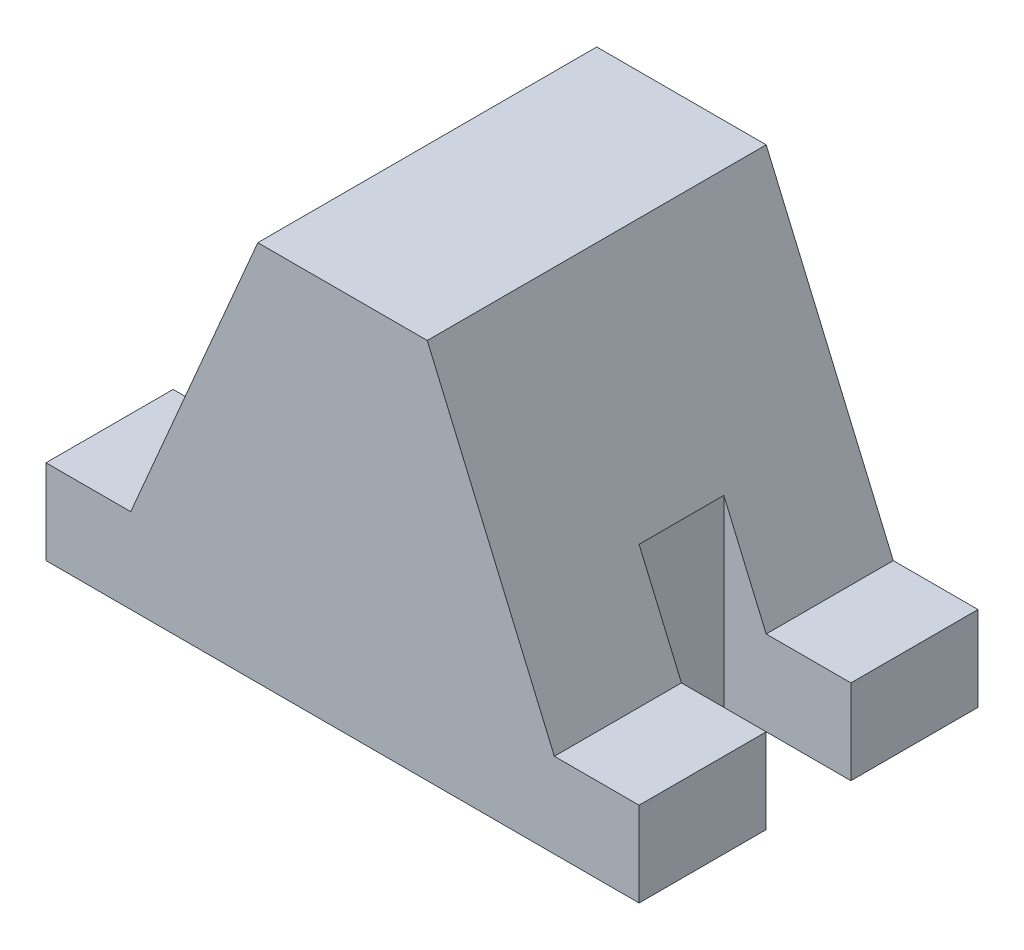
from build123d import *

# Parameters (mm, degrees)
SALIENTE_EXTRUIR1_DEPTH = 20
CORTAR_EXTRUIR2_REACH   = 62.415
CROQUIS2_W              = 15
CROQUIS2_H              = 10


with BuildPart() as part:
    # Croquis1 → Saliente-Extruir1 (new, symmetric)
    with BuildSketch(Plane.XY):
        Polygon((-35, 0), (35, 0), (35, 10), (25, 10), (10, 45), (-10, 45), (-25, 10), (-35, 10), align=None)
    extrude(amount=SALIENTE_EXTRUIR1_DEPTH, both=True)

    # Croquis2 → Cortar-Extruir2 (cut, up to next)
    with BuildSketch(Plane.XZ, mode=Mode.PRIVATE) as cortar_extruir2_sk1:
        with Locations((27.5, 0)):
            Rectangle(CROQUIS2_W, CROQUIS2_H)
    cortar_extruir2_tool1 = extrude(cortar_extruir2_sk1.sketch, amount=-CORTAR_EXTRUIR2_REACH, mode=Mode.PRIVATE) & part.part
    # Croquis2 → Cortar-Extruir2 (cut, up to next)
    with BuildSketch(Plane.XZ, mode=Mode.PRIVATE) as cortar_extruir2_sk2:
        with Locations((-27.5, 0)):
            Rectangle(CROQUIS2_W, CROQUIS2_H)
    cortar_extruir2_tool2 = extrude(cortar_extruir2_sk2.sketch, amount=-CORTAR_EXTRUIR2_REACH, mode=Mode.PRIVATE) & part.part
    add(cortar_extruir2_tool1.solids().sort_by_distance((27.5, 0, 0))[0], mode=Mode.SUBTRACT)
    add(cortar_extruir2_tool2.solids().sort_by_distance((-27.5, 0, 0))[0], mode=Mode.SUBTRACT)


solid = part.part
